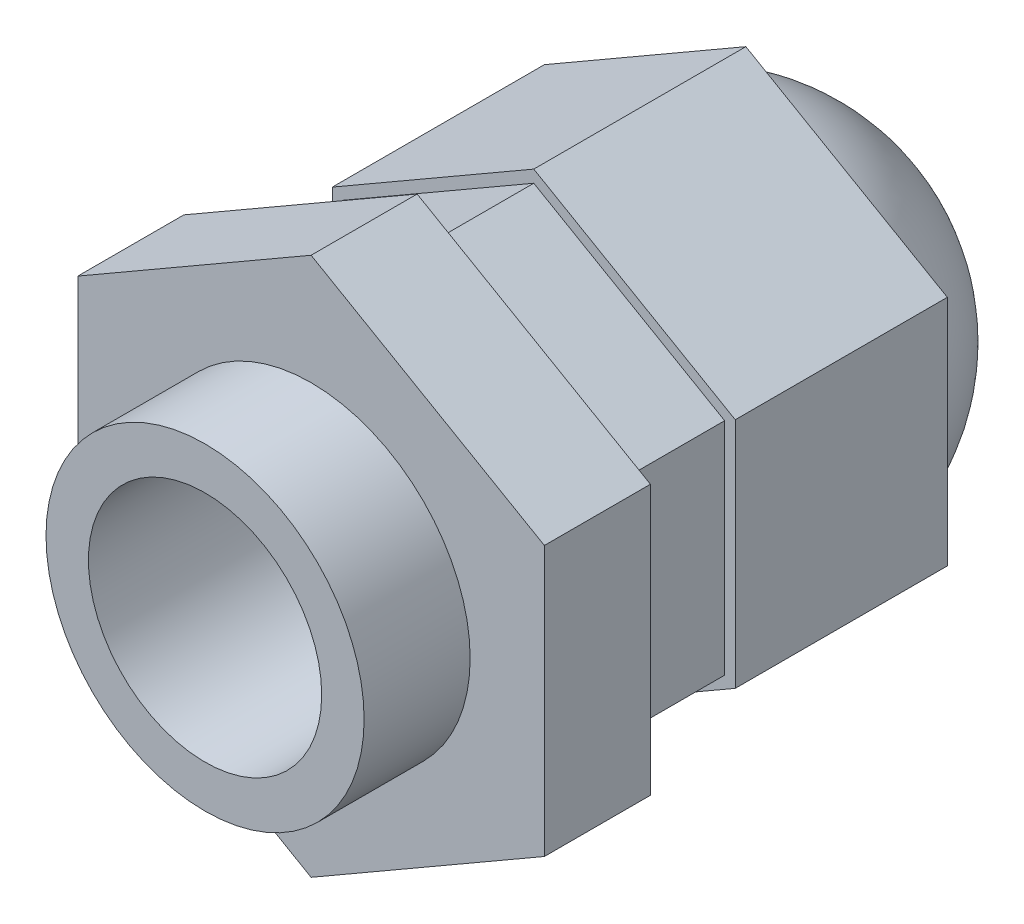
from build123d import *

# Parameters (mm, degrees)
SKETCH_1_R          = 7.5
EXTRUDE_1_DEPTH     = 5
EXTRUDE_2_DEPTH     = 5
SKETCH_3_R          = 7.5
EXTRUDE_3_DEPTH     = 1
EXTRUDE_4_DEPTH     = 4.5
EXTRUDE_5_DEPTH     = 10
SKETCH_6_R          = 9
EXTRUDE_6_DEPTH     = 0.1
DOME_1_FACE_RADIUS  = 9
DOME_1_HEIGHT       = 7
SKETCH_7_R          = 5.5
CUT_EXTRUDE_1_DEPTH = 24.5
SKETCH_8_R          = 4
CUT_EXTRUDE_2_DEPTH = 20
SKETCH_9_W          = 14.275225046
SKETCH_9_H          = 13.315546052
CUT_EXTRUDE_3_DEPTH = 20


with BuildPart() as part:
    # Эскиз1 → Вытянуть1 (new body)
    with BuildSketch(Plane.XY):
        Circle(SKETCH_1_R)
    extrude(amount=-EXTRUDE_1_DEPTH)

    # Эскиз2 → Вытянуть2 (add)
    with BuildSketch(Plane(origin=(0, 0, -5), x_dir=(-1, 0, 0), z_dir=(0, 0, -1))):
        Polygon((0, 12.701705922), (-11, 6.350852961), (-11, -6.350852961), (0, -12.701705922), (11, -6.350852961), (11, 6.350852961), align=None)
    extrude(amount=EXTRUDE_2_DEPTH)

    # Эскиз3 → Вытянуть3 (add)
    with BuildSketch(Plane(origin=(0, 0, -10), x_dir=(-1, 0, 0), z_dir=(0, 0, -1))):
        with Locations(Location((0, 0, 0), (0, 0, 180))):
            Circle(SKETCH_3_R)
    extrude(amount=EXTRUDE_3_DEPTH)

    # Эскиз4 → Вытянуть4 (add)
    with BuildSketch(Plane(origin=(0, 0, -11), x_dir=(-1, 0, 0), z_dir=(0, 0, -1))):
        Polygon((0, 10.392304845), (-9, 5.196152423), (-9, -5.196152423), (0, -10.392304845), (9, -5.196152423), (9, 5.196152423), align=None)
    extrude(amount=EXTRUDE_4_DEPTH)

    # Эскиз5 → Вытянуть5 (add)
    with BuildSketch(Plane(origin=(0, 0, -15.5), x_dir=(-1, 0, 0), z_dir=(0, 0, -1))):
        Polygon((0, 10.969655115), (-9.5, 5.484827557), (-9.5, -5.484827557), (0, -10.969655115), (9.5, -5.484827557), (9.5, 5.484827557), align=None)
    extrude(amount=EXTRUDE_5_DEPTH)

    # Эскиз6 → Вытянуть6 (add)
    with BuildSketch(Plane(origin=(0, 0, -25.5), x_dir=(-1, 0, 0), z_dir=(0, 0, -1))):
        with Locations(Location((0, 0, 0), (0, 0, 180))):
            Circle(SKETCH_6_R)
    extrude(amount=EXTRUDE_6_DEPTH)

    # Купол1: a dome of height H over a round flat face of radius A is a cap of a sphere of radius (A * A + H * H) / (2 * H)
    dome_1_r = (DOME_1_FACE_RADIUS * DOME_1_FACE_RADIUS + DOME_1_HEIGHT * DOME_1_HEIGHT) / (2 * DOME_1_HEIGHT)
    dome_1_base = Plane((0, 0, -25.6), z_dir=(0, 0, -1))
    with Locations(dome_1_base.offset(DOME_1_HEIGHT - dome_1_r)):
        dome_1_ball = Sphere(dome_1_r, mode=Mode.PRIVATE)
    add(split(dome_1_ball, bisect_by=dome_1_base, keep=Keep.TOP, mode=Mode.PRIVATE))

    # Эскиз7 → Вырез-Вытянуть1 (cut)
    with BuildSketch(Plane.XY):
        Circle(SKETCH_7_R)
    extrude(amount=-CUT_EXTRUDE_1_DEPTH, mode=Mode.SUBTRACT)

    # Эскиз8 → Вырез-Вытянуть2 (cut)
    with BuildSketch(Plane.XY.offset(-24.5)):
        Circle(SKETCH_8_R)
    extrude(amount=-CUT_EXTRUDE_2_DEPTH, mode=Mode.SUBTRACT)

    # Эскиз9 → Вырез-Вытянуть3 (cut)
    with BuildSketch(Plane.XY.offset(-31)):
        with Locations((-0.20992978, 0.329889654)):
            Rectangle(SKETCH_9_W, SKETCH_9_H)
    extrude(amount=-CUT_EXTRUDE_3_DEPTH, mode=Mode.SUBTRACT)


solid = part.part
